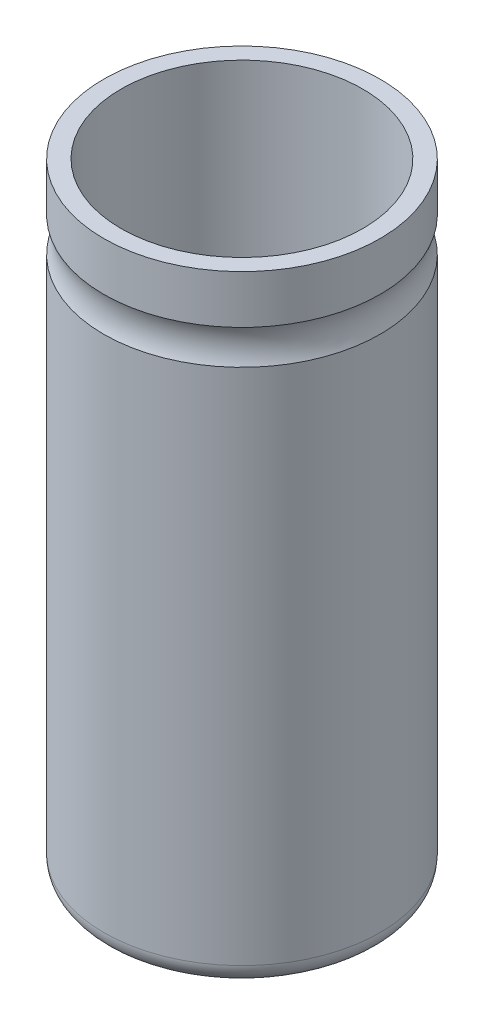
from build123d import *

# Parameters (mm, degrees)
FILLET4_R = 3000


with BuildPart() as part:
    # Sketch7 → Revolve1 (revolve)
    with BuildSketch(Plane.XY, mode=Mode.PRIVATE) as revolve1_sk:
        with BuildLine():
            Line((0, 0), (20000, 0))
            Line((20000, 0), (20000, 78000))
            ThreePointArc((20000, 78000), (19454.356057318, 80500), (20000, 83000))
            Line((20000, 83000), (20000, 90000))
            Line((20000, 90000), (17500, 90000))
            Line((17500, 90000), (17500, 3000))
            Line((17500, 3000), (0, 3000))
            Line((0, 3000), (0, 0))
        make_face()
    revolve(revolve1_sk.sketch.rotate(Axis((0, 3000, 0), (0, -1, 0)), 90), axis=Axis((0, 3000, 0), (0, -1, 0)))

    # Fillet4
    fillet4_edges = [part.edges().sort_by_distance(p)[0] for p in [
        (0, 0, -20000),
    ]]
    fillet(fillet4_edges, radius=FILLET4_R)


solid = part.part
